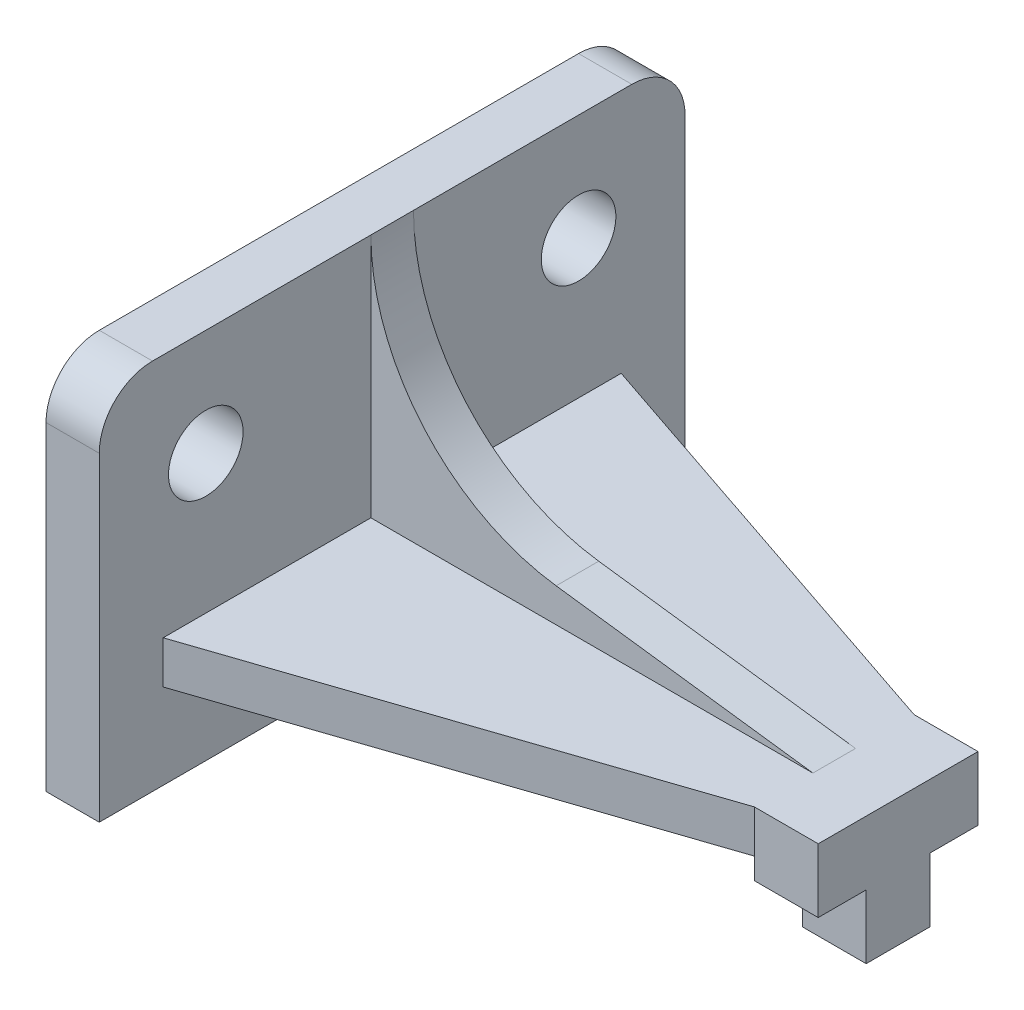
from build123d import *

# Parameters (mm, degrees)
SKETCH1_R           = 7
BOSS_EXTRUDE1_DEPTH = 10
BOSS_EXTRUDE2_DEPTH = 12
BOSS_EXTRUDE3_DEPTH = 4
BOSS_EXTRUDE4_START = -15
BOSS_EXTRUDE4_DEPTH = 4


with BuildPart() as part:
    # Sketch1 → Boss-Extrude1 (new body)
    with BuildSketch(Plane(origin=(0, 0, 0), x_dir=(0, 0, -1), z_dir=(1, 0, 0))):
        with BuildLine():
            Line((-45, 35), (45, 35))
            ThreePointArc((45, 35), (52.071067812, 32.071067812), (55, 25))
            Line((55, 25), (55, -35))
            Line((55, -35), (-55, -35))
            Line((-55, -35), (-55, 25))
            ThreePointArc((-55, 25), (-52.071067812, 32.071067812), (-45, 35))
        make_face()
        with Locations((-35, 15)):
            Circle(SKETCH1_R, mode=Mode.SUBTRACT)
        with Locations(Location((35, 15, 0), (0, 0, 180))):
            Circle(SKETCH1_R, mode=Mode.SUBTRACT)
    extrude(amount=BOSS_EXTRUDE1_DEPTH)



with BuildPart() as body_2:
    # Sketch4 → Boss-Extrude2 (new body)
    with BuildSketch(Plane.ZY.offset(-105)):
        Polygon((6, -35), (6, -23), (15, -23), (15, -11), (-15, -11), (-15, -23), (-6, -23), (-6, -35), align=None)
    extrude(amount=BOSS_EXTRUDE2_DEPTH)


with BuildPart() as part_1:
    add(part.part)

    add(body_2.part)  # Boss-Extrude3 merges body 2
    # Sketch5 → Boss-Extrude3 (add, symmetric)
    with BuildSketch(Plane.XY):
        with BuildLine():
            Line((44.783977599, -4.658455723), (93, -11))
            Line((93, -11), (93, -15))
            Line((93, -15), (10, -15))
            Line((10, -15), (10, 35))
            ThreePointArc((10, 35), (19.928078744, 8.624262058), (44.783977599, -4.658455723))
        make_face()
    extrude(amount=BOSS_EXTRUDE3_DEPTH, both=True)

    # Sketch6 → Boss-Extrude4 (add, symmetric)
    with BuildSketch(Plane(origin=(0, 0, 0), x_dir=(1, 0, 0), z_dir=(0, 1, 0)).offset(BOSS_EXTRUDE4_START)):
        Polygon((93, -15), (93, -4), (93, 4), (93, 15), (10, 43), (10, -43), align=None)
    extrude(amount=BOSS_EXTRUDE4_DEPTH, both=True)


solid = part_1.part
